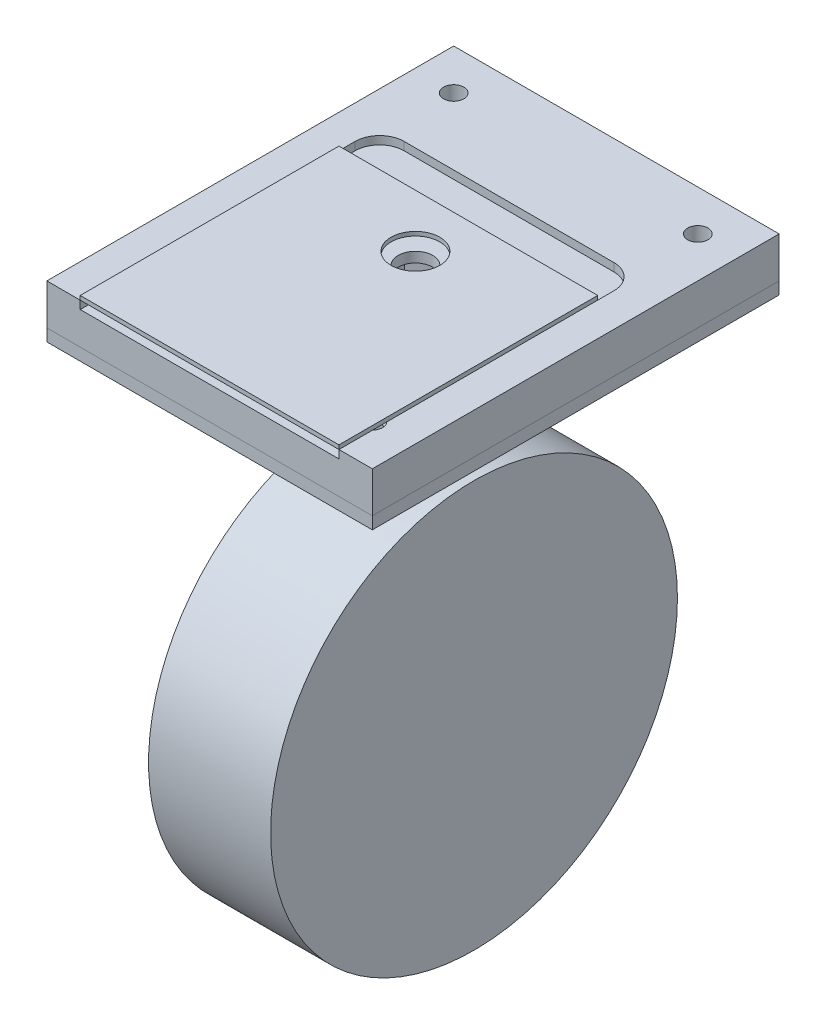
from build123d import *

# Parameters (mm, degrees)
SKETCH1_R                  = 50
BOSS_EXTRUDE1_DEPTH        = 15
BOSS_EXTRUDE2_START        = 130
SKETCH2_W                  = 80
SKETCH2_H                  = 100
SKETCH2_R                  = 4.75
BOSS_EXTRUDE2_DEPTH        = 3
BOSS_EXTRUDE3_START        = 8
SKETCH3_W                  = 63.6
SKETCH3_H                  = 63.6
SKETCH3_R                  = 6
BOSS_EXTRUDE3_DEPTH        = 3
SKETCH4_W                  = 80
SKETCH4_H                  = 100
BOSS_EXTRUDE4_DEPTH        = 10
SKETCH6_W                  = 2.5
SKETCH6_H                  = 140
M6_TAPPED_HOLE1_AT_2_COUNT = 2
M6_TAPPED_HOLE1_AT_2_PITCH = 60
M6_TAPPED_HOLE1_AT_3_COUNT = 2
M6_TAPPED_HOLE1_AT_3_PITCH = 80
M6_TAPPED_HOLE1_AT_4_COUNT = 2
M6_TAPPED_HOLE1_AT_4_PITCH = 100
SKETCH7_R                  = 4.25
CUT_EXTRUDE1_DEPTH         = 154.948043183
CUT_EXTRUDE2_DEPTH         = 2
CUT_EXTRUDE3_DEPTH         = 5.5


with BuildPart() as part:
    # Sketch1 → Boss-Extrude1 (new, symmetric)
    with BuildSketch(Plane(origin=(0, 0, 0), x_dir=(0, 0, -1), z_dir=(1, 0, 0))):
        with Locations((0, 50)):
            Circle(SKETCH1_R)
    extrude(amount=BOSS_EXTRUDE1_DEPTH, both=True)


with BuildPart() as body_2:
    # Sketch2 → Boss-Extrude2 (new body)
    with BuildSketch(Plane(origin=(0, 0, 0), x_dir=(1, 0, 0), z_dir=(0, 1, 0)).offset(BOSS_EXTRUDE2_START)):
        Rectangle(SKETCH2_W, SKETCH2_H)
        with Locations(Location((-30, 40, 0), (0, 0, 270))):
            Circle(SKETCH2_R, mode=Mode.SUBTRACT)
        with Locations(Location((30, 40, 0), (0, 0, 270))):
            Circle(SKETCH2_R, mode=Mode.SUBTRACT)
        with Locations(Location((-30, -40, 0), (0, 0, 270))):
            Circle(SKETCH2_R, mode=Mode.SUBTRACT)
        with Locations(Location((30, -40, 0), (0, 0, 270))):
            Circle(SKETCH2_R, mode=Mode.SUBTRACT)
    extrude(amount=-BOSS_EXTRUDE2_DEPTH)


with BuildPart() as body_3:
    # Sketch3 → Boss-Extrude3 (new body)
    with BuildSketch(Plane(origin=(0, 130, 0), x_dir=(1, 0, 0), z_dir=(0, 1, 0)).offset(BOSS_EXTRUDE3_START)):
        with Locations((0, -18.2)):
            Rectangle(SKETCH3_W, SKETCH3_H)
        with Locations(Location((0, 0.6, 0), (0, 0, 270))):
            Circle(SKETCH3_R, mode=Mode.SUBTRACT)
    extrude(amount=BOSS_EXTRUDE3_DEPTH)


with BuildPart() as body_4:
    # Sketch4 → Boss-Extrude4 (new body)
    with BuildSketch(Plane(origin=(0, 130, 0), x_dir=(1, 0, 0), z_dir=(0, 1, 0))):
        Rectangle(SKETCH4_W, SKETCH4_H)
    extrude(amount=BOSS_EXTRUDE4_DEPTH)

    # Sketch6 → M6 Tapped Hole1 (revolve, cut)
    with BuildSketch(Plane(origin=(-30, 140, -40), x_dir=(0, 0, 1), z_dir=(1, 0, 0))):
        with Locations((1.25, 70)):
            Rectangle(SKETCH6_W, SKETCH6_H)
    m6_tapped_hole1 = revolve(axis=Axis((-30, 146.35, -40), (0, -1, 0)), mode=Mode.SUBTRACT)

    # M6 Tapped Hole1 at 2: M6 Tapped Hole1 ×2
    with Locations(*[(i * M6_TAPPED_HOLE1_AT_2_PITCH, 0, 0) for i in range(1, M6_TAPPED_HOLE1_AT_2_COUNT)]):
        add(m6_tapped_hole1, mode=Mode.SUBTRACT)

    # M6 Tapped Hole1 at 3: M6 Tapped Hole1 ×2
    with Locations(*[(0, 0, i * M6_TAPPED_HOLE1_AT_3_PITCH) for i in range(1, M6_TAPPED_HOLE1_AT_3_COUNT)]):
        add(m6_tapped_hole1, mode=Mode.SUBTRACT)

    # M6 Tapped Hole1 at 4: M6 Tapped Hole1 ×2
    with Locations(*[Vector(0.6, 0, 0.8) * (i * M6_TAPPED_HOLE1_AT_4_PITCH) for i in range(1, M6_TAPPED_HOLE1_AT_4_COUNT)]):
        add(m6_tapped_hole1, mode=Mode.SUBTRACT)

    # Sketch7 → Cut-Extrude1 (cut, through all)
    with BuildSketch(Plane(origin=(0, 140, 0), x_dir=(1, 0, 0), z_dir=(0, 1, 0))):
        with Locations(Location((0, 0.6, 0), (0, 0, 270))):
            Circle(SKETCH7_R)
    extrude(amount=-CUT_EXTRUDE1_DEPTH, mode=Mode.SUBTRACT)


with BuildPart() as cut_extrude2_tool:
    # Sketch8 → Cut-Extrude2 (new body)
    with BuildSketch(Plane(origin=(0, 140, 0), x_dir=(1, 0, 0), z_dir=(0, 1, 0))):
        with BuildLine():
            Line((-31.8, -50), (31.8, -50))
            Line((31.8, -50), (31.8, 17.6))
            ThreePointArc((31.8, 17.6), (30.042640687, 21.842640687), (25.8, 23.6))
            Line((25.8, 23.6), (-25.8, 23.6))
            ThreePointArc((-25.8, 23.6), (-30.042640687, 21.842640687), (-31.8, 17.6))
            Line((-31.8, 17.6), (-31.8, -50))
        make_face()
    extrude(amount=-CUT_EXTRUDE2_DEPTH)


with BuildPart() as body_3_1:
    add(body_3.part)

    # Cut-Extrude2: cut by cut_extrude2_tool
    add(cut_extrude2_tool.part, mode=Mode.SUBTRACT)


with BuildPart() as body_4_1:
    add(body_4.part)

    # Cut-Extrude2: cut by cut_extrude2_tool
    add(cut_extrude2_tool.part, mode=Mode.SUBTRACT)

    # Sketch9 → Cut-Extrude3 (cut)
    with BuildSketch(Plane.XZ.offset(-130)):
        Polygon((0, 6.790083446), (-6.4, 3.095041723), (-6.4, -4.295041723), (0, -7.990083446), (6.4, -4.295041723), (6.4, 3.095041723), align=None)
    extrude(amount=-CUT_EXTRUDE3_DEPTH, mode=Mode.SUBTRACT)


solid = Compound([part.part, body_2.part, body_3_1.part, body_4_1.part])
